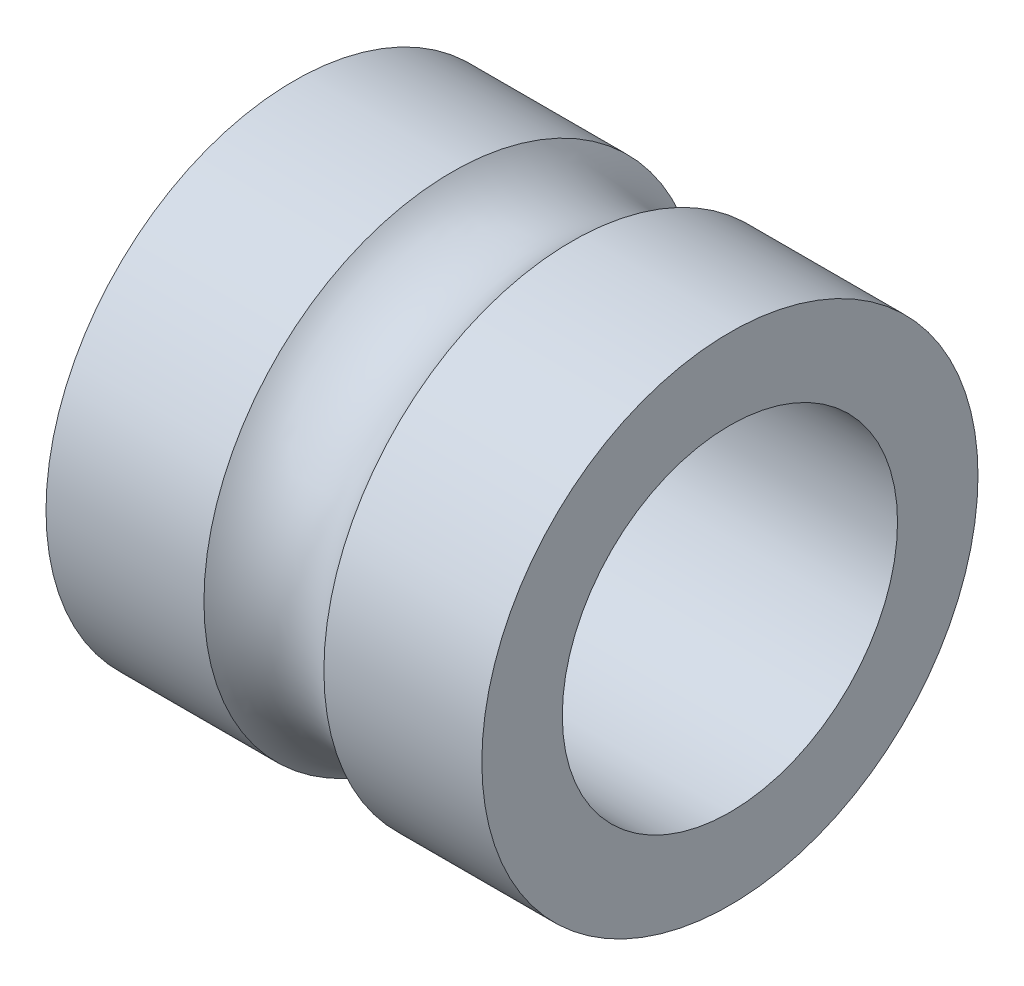
from build123d import *


with BuildPart() as part:
    # Sketch1 → Revolve1 (revolve)
    with BuildSketch(Plane.XY, mode=Mode.PRIVATE) as revolve1_sk:
        with BuildLine():
            Line((2.752083666, 11.384615385), (10, 11.384615385))
            Line((10, 11.384615385), (10, 7.69230769))
            Line((10, 7.69230769), (-10, 7.69230769))
            Line((-10, 7.69230769), (-10, 11.384615385))
            Line((-10, 11.384615385), (-2.752083666, 11.384615385))
            ThreePointArc((-2.752083666, 11.384615385), (0, 10.153846152), (2.752083666, 11.384615385))
        make_face()
    revolve(revolve1_sk.sketch.rotate(Axis((0, 0, 0), (1, 0, 0)), 90), axis=Axis((0, 0, 0), (1, 0, 0)))


solid = part.part
